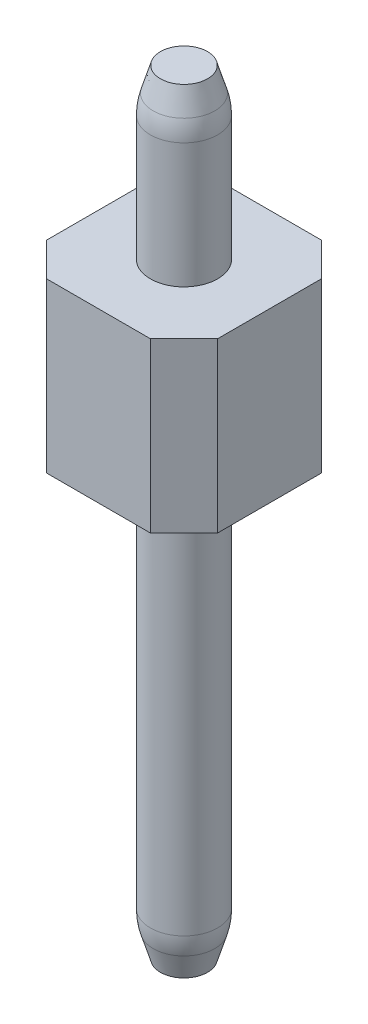
from build123d import *
from OCP.BRepFilletAPI import BRepFilletAPI_MakeChamfer

# Parameters (mm, degrees)
SKETCH1_R               = 0.5
BOSS_EXTRUDE1_DEPTH     = 11.5
BOSS_EXTRUDE1_2_DEPTH   = 11.5
BOSS_EXTRUDE1_3_DEPTH   = 11.5
BOSS_EXTRUDE1_4_DEPTH   = 11.5
BOSS_EXTRUDE1_5_DEPTH   = 11.5
BOSS_EXTRUDE1_6_DEPTH   = 11.5
BOSS_EXTRUDE1_7_DEPTH   = 11.5
BOSS_EXTRUDE1_8_DEPTH   = 11.5
BOSS_EXTRUDE1_9_DEPTH   = 11.5
BOSS_EXTRUDE1_10_DEPTH  = 11.5
BOSS_EXTRUDE1_11_DEPTH  = 11.5
BOSS_EXTRUDE1_12_DEPTH  = 11.5
BOSS_EXTRUDE1_13_DEPTH  = 11.5
BOSS_EXTRUDE1_14_DEPTH  = 11.5
BOSS_EXTRUDE1_15_DEPTH  = 11.5
BOSS_EXTRUDE1_16_DEPTH  = 11.5
BOSS_EXTRUDE2_DEPTH     = 2.5
CHAMFER1_SIZE           = 0.5
CHAMFER1_SIZE2          = 0.15
FILLET1_R               = 1
CHAMFER2_SIZE           = 0.15
CHAMFER2_SIZE2          = 0.5
FILLET2_R               = 1
CUT_EXTRUDE1_DEPTH      = 42.093776929
CUT_EXTRUDE1_DEPTH_BACK = 42.093776929
SKETCH3_W               = 38.1
SKETCH3_H               = 11.5


with BuildPart() as part:
    # Sketch1 → Boss-Extrude1 (new body)
    with BuildSketch(Plane(origin=(0, 0, 0), x_dir=(1, 0, 0), z_dir=(0, 1, 0))):
        with Locations(Location((0, 0, 0), (0, 0, 270))):
            Circle(SKETCH1_R)
    extrude(amount=BOSS_EXTRUDE1_DEPTH)



with BuildPart() as body_2:
    # Sketch1 → Boss-Extrude1 2 (new body)
    with BuildSketch(Plane(origin=(0, 0, 0), x_dir=(1, 0, 0), z_dir=(0, 1, 0))):
        with Locations(Location((2.54, 0, 0), (0, 0, 270))):
            Circle(SKETCH1_R)
    extrude(amount=BOSS_EXTRUDE1_2_DEPTH)


with BuildPart() as body_3:
    # Sketch1 → Boss-Extrude1 3 (new body)
    with BuildSketch(Plane(origin=(0, 0, 0), x_dir=(1, 0, 0), z_dir=(0, 1, 0))):
        with Locations(Location((5.08, 0, 0), (0, 0, 270))):
            Circle(SKETCH1_R)
    extrude(amount=BOSS_EXTRUDE1_3_DEPTH)


with BuildPart() as body_4:
    # Sketch1 → Boss-Extrude1 4 (new body)
    with BuildSketch(Plane(origin=(0, 0, 0), x_dir=(1, 0, 0), z_dir=(0, 1, 0))):
        with Locations(Location((7.62, 0, 0), (0, 0, 270))):
            Circle(SKETCH1_R)
    extrude(amount=BOSS_EXTRUDE1_4_DEPTH)


with BuildPart() as body_5:
    # Sketch1 → Boss-Extrude1 5 (new body)
    with BuildSketch(Plane(origin=(0, 0, 0), x_dir=(1, 0, 0), z_dir=(0, 1, 0))):
        with Locations(Location((10.16, 0, 0), (0, 0, 270))):
            Circle(SKETCH1_R)
    extrude(amount=BOSS_EXTRUDE1_5_DEPTH)


with BuildPart() as body_6:
    # Sketch1 → Boss-Extrude1 6 (new body)
    with BuildSketch(Plane(origin=(0, 0, 0), x_dir=(1, 0, 0), z_dir=(0, 1, 0))):
        with Locations(Location((12.7, 0, 0), (0, 0, 270))):
            Circle(SKETCH1_R)
    extrude(amount=BOSS_EXTRUDE1_6_DEPTH)


with BuildPart() as body_7:
    # Sketch1 → Boss-Extrude1 7 (new body)
    with BuildSketch(Plane(origin=(0, 0, 0), x_dir=(1, 0, 0), z_dir=(0, 1, 0))):
        with Locations(Location((15.24, 0, 0), (0, 0, 270))):
            Circle(SKETCH1_R)
    extrude(amount=BOSS_EXTRUDE1_7_DEPTH)


with BuildPart() as body_8:
    # Sketch1 → Boss-Extrude1 8 (new body)
    with BuildSketch(Plane(origin=(0, 0, 0), x_dir=(1, 0, 0), z_dir=(0, 1, 0))):
        with Locations(Location((17.78, 0, 0), (0, 0, 270))):
            Circle(SKETCH1_R)
    extrude(amount=BOSS_EXTRUDE1_8_DEPTH)


with BuildPart() as body_9:
    # Sketch1 → Boss-Extrude1 9 (new body)
    with BuildSketch(Plane(origin=(0, 0, 0), x_dir=(1, 0, 0), z_dir=(0, 1, 0))):
        with Locations(Location((20.32, 0, 0), (0, 0, 270))):
            Circle(SKETCH1_R)
    extrude(amount=BOSS_EXTRUDE1_9_DEPTH)


with BuildPart() as body_10:
    # Sketch1 → Boss-Extrude1 10 (new body)
    with BuildSketch(Plane(origin=(0, 0, 0), x_dir=(1, 0, 0), z_dir=(0, 1, 0))):
        with Locations(Location((22.86, 0, 0), (0, 0, 270))):
            Circle(SKETCH1_R)
    extrude(amount=BOSS_EXTRUDE1_10_DEPTH)


with BuildPart() as body_11:
    # Sketch1 → Boss-Extrude1 11 (new body)
    with BuildSketch(Plane(origin=(0, 0, 0), x_dir=(1, 0, 0), z_dir=(0, 1, 0))):
        with Locations(Location((25.4, 0, 0), (0, 0, 270))):
            Circle(SKETCH1_R)
    extrude(amount=BOSS_EXTRUDE1_11_DEPTH)


with BuildPart() as body_12:
    # Sketch1 → Boss-Extrude1 12 (new body)
    with BuildSketch(Plane(origin=(0, 0, 0), x_dir=(1, 0, 0), z_dir=(0, 1, 0))):
        with Locations(Location((27.94, 0, 0), (0, 0, 270))):
            Circle(SKETCH1_R)
    extrude(amount=BOSS_EXTRUDE1_12_DEPTH)


with BuildPart() as body_13:
    # Sketch1 → Boss-Extrude1 13 (new body)
    with BuildSketch(Plane(origin=(0, 0, 0), x_dir=(1, 0, 0), z_dir=(0, 1, 0))):
        with Locations(Location((30.48, 0, 0), (0, 0, 270))):
            Circle(SKETCH1_R)
    extrude(amount=BOSS_EXTRUDE1_13_DEPTH)


with BuildPart() as body_14:
    # Sketch1 → Boss-Extrude1 14 (new body)
    with BuildSketch(Plane(origin=(0, 0, 0), x_dir=(1, 0, 0), z_dir=(0, 1, 0))):
        with Locations(Location((33.02, 0, 0), (0, 0, 270))):
            Circle(SKETCH1_R)
    extrude(amount=BOSS_EXTRUDE1_14_DEPTH)


with BuildPart() as body_15:
    # Sketch1 → Boss-Extrude1 15 (new body)
    with BuildSketch(Plane(origin=(0, 0, 0), x_dir=(1, 0, 0), z_dir=(0, 1, 0))):
        with Locations(Location((35.56, 0, 0), (0, 0, 270))):
            Circle(SKETCH1_R)
    extrude(amount=BOSS_EXTRUDE1_15_DEPTH)


with BuildPart() as body_16:
    # Sketch1 → Boss-Extrude1 16 (new body)
    with BuildSketch(Plane(origin=(0, 0, 0), x_dir=(1, 0, 0), z_dir=(0, 1, 0))):
        with Locations(Location((38.1, 0, 0), (0, 0, 270))):
            Circle(SKETCH1_R)
    extrude(amount=BOSS_EXTRUDE1_16_DEPTH)


with BuildPart() as part_1:
    add(part.part)

    add(body_2.part)  # Boss-Extrude2 merges body 2

    add(body_3.part)  # Boss-Extrude2 merges body 3

    add(body_4.part)  # Boss-Extrude2 merges body 4

    add(body_5.part)  # Boss-Extrude2 merges body 5

    add(body_6.part)  # Boss-Extrude2 merges body 6

    add(body_7.part)  # Boss-Extrude2 merges body 7

    add(body_8.part)  # Boss-Extrude2 merges body 8

    add(body_9.part)  # Boss-Extrude2 merges body 9

    add(body_10.part)  # Boss-Extrude2 merges body 10

    add(body_11.part)  # Boss-Extrude2 merges body 11

    add(body_12.part)  # Boss-Extrude2 merges body 12

    add(body_13.part)  # Boss-Extrude2 merges body 13

    add(body_14.part)  # Boss-Extrude2 merges body 14

    add(body_15.part)  # Boss-Extrude2 merges body 15

    add(body_16.part)  # Boss-Extrude2 merges body 16
    # Sketch2 → Boss-Extrude2 (add)
    with BuildSketch(Plane(origin=(0, 6.5, 0), x_dir=(1, 0, 0), z_dir=(0, 1, 0))):
        Polygon((-1.27, 0.77), (-0.77, 1.27), (0.77, 1.27), (1.27, 0.77), (1.77, 1.27), (3.31, 1.27), (3.81, 0.77), (4.31, 1.27), (5.85, 1.27), (6.35, 0.77), (6.85, 1.27), (8.39, 1.27), (8.89, 0.77), (9.39, 1.27), (10.93, 1.27), (11.43, 0.77), (11.93, 1.27), (13.47, 1.27), (13.97, 0.77), (14.47, 1.27), (16.01, 1.27), (16.51, 0.77), (17.01, 1.27), (18.55, 1.27), (19.05, 0.77), (19.55, 1.27), (21.09, 1.27), (21.59, 0.77), (22.09, 1.27), (23.63, 1.27), (24.13, 0.77), (24.63, 1.27), (26.17, 1.27), (26.67, 0.77), (27.17, 1.27), (28.71, 1.27), (29.21, 0.77), (29.71, 1.27), (31.25, 1.27), (31.75, 0.77), (32.25, 1.27), (33.79, 1.27), (34.29, 0.77), (34.79, 1.27), (36.33, 1.27), (36.83, 0.77), (37.33, 1.27), (38.87, 1.27), (39.37, 0.77), (39.37, -0.77), (38.87, -1.27), (37.33, -1.27), (36.83, -0.77), (36.33, -1.27), (34.79, -1.27), (34.29, -0.77), (33.79, -1.27), (32.25, -1.27), (31.75, -0.77), (31.25, -1.27), (29.71, -1.27), (29.21, -0.77), (28.71, -1.27), (27.17, -1.27), (26.67, -0.77), (26.17, -1.27), (24.63, -1.27), (24.13, -0.77), (23.63, -1.27), (22.09, -1.27), (21.59, -0.77), (21.09, -1.27), (19.55, -1.27), (19.05, -0.77), (18.55, -1.27), (17.01, -1.27), (16.51, -0.77), (16.01, -1.27), (14.47, -1.27), (13.97, -0.77), (13.47, -1.27), (11.93, -1.27), (11.43, -0.77), (10.93, -1.27), (9.39, -1.27), (8.89, -0.77), (8.39, -1.27), (6.85, -1.27), (6.35, -0.77), (5.85, -1.27), (4.31, -1.27), (3.81, -0.77), (3.31, -1.27), (1.77, -1.27), (1.27, -0.77), (0.77, -1.27), (-0.77, -1.27), (-1.27, -0.77), align=None)
    extrude(amount=BOSS_EXTRUDE2_DEPTH)

    # Chamfer1: one chamfer whose edges measure the first distance from different faces: ONE call of the kernel's chamfer builder (chamfer() names one face for all edges)
    chamfer1_edges_1 = [part_1.edges().sort_by_distance(p)[0] for p in [
        (2.54, 11.5, -0.5),
    ]]
    chamfer1_side_1 = [part_1.faces().sort_by_distance(p)[0] for p in [
        (2.54, 10.25, -0.5),
    ]]
    chamfer1_edges_2 = [part_1.edges().sort_by_distance(p)[0] for p in [
        (5.08, 11.5, -0.5),
    ]]
    chamfer1_side_2 = [part_1.faces().sort_by_distance(p)[0] for p in [
        (5.08, 10.25, -0.5),
    ]]
    chamfer1_edges_3 = [part_1.edges().sort_by_distance(p)[0] for p in [
        (7.62, 11.5, -0.5),
    ]]
    chamfer1_side_3 = [part_1.faces().sort_by_distance(p)[0] for p in [
        (7.62, 10.25, -0.5),
    ]]
    chamfer1_edges_4 = [part_1.edges().sort_by_distance(p)[0] for p in [
        (10.16, 11.5, -0.5),
    ]]
    chamfer1_side_4 = [part_1.faces().sort_by_distance(p)[0] for p in [
        (10.16, 10.25, -0.5),
    ]]
    chamfer1_edges_5 = [part_1.edges().sort_by_distance(p)[0] for p in [
        (12.7, 11.5, -0.5),
    ]]
    chamfer1_side_5 = [part_1.faces().sort_by_distance(p)[0] for p in [
        (12.7, 10.25, -0.5),
    ]]
    chamfer1_edges_6 = [part_1.edges().sort_by_distance(p)[0] for p in [
        (15.24, 11.5, -0.5),
    ]]
    chamfer1_side_6 = [part_1.faces().sort_by_distance(p)[0] for p in [
        (15.24, 10.25, -0.5),
    ]]
    chamfer1_edges_7 = [part_1.edges().sort_by_distance(p)[0] for p in [
        (17.78, 11.5, -0.5),
    ]]
    chamfer1_side_7 = [part_1.faces().sort_by_distance(p)[0] for p in [
        (17.78, 10.25, -0.5),
    ]]
    chamfer1_edges_8 = [part_1.edges().sort_by_distance(p)[0] for p in [
        (20.32, 11.5, -0.5),
    ]]
    chamfer1_side_8 = [part_1.faces().sort_by_distance(p)[0] for p in [
        (20.32, 10.25, -0.5),
    ]]
    chamfer1_edges_9 = [part_1.edges().sort_by_distance(p)[0] for p in [
        (22.86, 11.5, -0.5),
    ]]
    chamfer1_side_9 = [part_1.faces().sort_by_distance(p)[0] for p in [
        (22.86, 10.25, -0.5),
    ]]
    chamfer1_edges_10 = [part_1.edges().sort_by_distance(p)[0] for p in [
        (25.4, 11.5, -0.5),
    ]]
    chamfer1_side_10 = [part_1.faces().sort_by_distance(p)[0] for p in [
        (25.4, 10.25, -0.5),
    ]]
    chamfer1_edges_11 = [part_1.edges().sort_by_distance(p)[0] for p in [
        (27.94, 11.5, -0.5),
    ]]
    chamfer1_side_11 = [part_1.faces().sort_by_distance(p)[0] for p in [
        (27.94, 10.25, -0.5),
    ]]
    chamfer1_edges_12 = [part_1.edges().sort_by_distance(p)[0] for p in [
        (30.48, 11.5, -0.5),
    ]]
    chamfer1_side_12 = [part_1.faces().sort_by_distance(p)[0] for p in [
        (30.48, 10.25, -0.5),
    ]]
    chamfer1_edges_13 = [part_1.edges().sort_by_distance(p)[0] for p in [
        (33.02, 11.5, -0.5),
    ]]
    chamfer1_side_13 = [part_1.faces().sort_by_distance(p)[0] for p in [
        (33.02, 10.25, -0.5),
    ]]
    chamfer1_edges_14 = [part_1.edges().sort_by_distance(p)[0] for p in [
        (35.56, 11.5, -0.5),
    ]]
    chamfer1_side_14 = [part_1.faces().sort_by_distance(p)[0] for p in [
        (35.56, 10.25, -0.5),
    ]]
    chamfer1_edges_15 = [part_1.edges().sort_by_distance(p)[0] for p in [
        (38.1, 11.5, -0.5),
    ]]
    chamfer1_side_15 = [part_1.faces().sort_by_distance(p)[0] for p in [
        (38.1, 10.25, -0.5),
    ]]
    chamfer1_edges_16 = [part_1.edges().sort_by_distance(p)[0] for p in [
        (0, 11.5, -0.5),
    ]]
    chamfer1_side_16 = [part_1.faces().sort_by_distance(p)[0] for p in [
        (0, 10.25, -0.5),
    ]]
    chamfer1 = BRepFilletAPI_MakeChamfer(part_1.part.solid().wrapped)
    for e in chamfer1_edges_1:
        chamfer1.Add(CHAMFER1_SIZE, CHAMFER1_SIZE2, e.wrapped, chamfer1_side_1[0].wrapped)  # the first distance lies on this face
    for e in chamfer1_edges_2:
        chamfer1.Add(CHAMFER1_SIZE, CHAMFER1_SIZE2, e.wrapped, chamfer1_side_2[0].wrapped)  # the first distance lies on this face
    for e in chamfer1_edges_3:
        chamfer1.Add(CHAMFER1_SIZE, CHAMFER1_SIZE2, e.wrapped, chamfer1_side_3[0].wrapped)  # the first distance lies on this face
    for e in chamfer1_edges_4:
        chamfer1.Add(CHAMFER1_SIZE, CHAMFER1_SIZE2, e.wrapped, chamfer1_side_4[0].wrapped)  # the first distance lies on this face
    for e in chamfer1_edges_5:
        chamfer1.Add(CHAMFER1_SIZE, CHAMFER1_SIZE2, e.wrapped, chamfer1_side_5[0].wrapped)  # the first distance lies on this face
    for e in chamfer1_edges_6:
        chamfer1.Add(CHAMFER1_SIZE, CHAMFER1_SIZE2, e.wrapped, chamfer1_side_6[0].wrapped)  # the first distance lies on this face
    for e in chamfer1_edges_7:
        chamfer1.Add(CHAMFER1_SIZE, CHAMFER1_SIZE2, e.wrapped, chamfer1_side_7[0].wrapped)  # the first distance lies on this face
    for e in chamfer1_edges_8:
        chamfer1.Add(CHAMFER1_SIZE, CHAMFER1_SIZE2, e.wrapped, chamfer1_side_8[0].wrapped)  # the first distance lies on this face
    for e in chamfer1_edges_9:
        chamfer1.Add(CHAMFER1_SIZE, CHAMFER1_SIZE2, e.wrapped, chamfer1_side_9[0].wrapped)  # the first distance lies on this face
    for e in chamfer1_edges_10:
        chamfer1.Add(CHAMFER1_SIZE, CHAMFER1_SIZE2, e.wrapped, chamfer1_side_10[0].wrapped)  # the first distance lies on this face
    for e in chamfer1_edges_11:
        chamfer1.Add(CHAMFER1_SIZE, CHAMFER1_SIZE2, e.wrapped, chamfer1_side_11[0].wrapped)  # the first distance lies on this face
    for e in chamfer1_edges_12:
        chamfer1.Add(CHAMFER1_SIZE, CHAMFER1_SIZE2, e.wrapped, chamfer1_side_12[0].wrapped)  # the first distance lies on this face
    for e in chamfer1_edges_13:
        chamfer1.Add(CHAMFER1_SIZE, CHAMFER1_SIZE2, e.wrapped, chamfer1_side_13[0].wrapped)  # the first distance lies on this face
    for e in chamfer1_edges_14:
        chamfer1.Add(CHAMFER1_SIZE, CHAMFER1_SIZE2, e.wrapped, chamfer1_side_14[0].wrapped)  # the first distance lies on this face
    for e in chamfer1_edges_15:
        chamfer1.Add(CHAMFER1_SIZE, CHAMFER1_SIZE2, e.wrapped, chamfer1_side_15[0].wrapped)  # the first distance lies on this face
    for e in chamfer1_edges_16:
        chamfer1.Add(CHAMFER1_SIZE, CHAMFER1_SIZE2, e.wrapped, chamfer1_side_16[0].wrapped)  # the first distance lies on this face
    add(Compound.cast(chamfer1.Shape()), mode=Mode.REPLACE)

    # Fillet1
    fillet1_edges = [part_1.edges().sort_by_distance(p)[0] for p in [
        (38.1, 11, -0.5),
        (35.56, 11, -0.5),
        (33.02, 11, -0.5),
        (30.48, 11, -0.5),
        (27.94, 11, -0.5),
        (25.4, 11, -0.5),
        (22.86, 11, -0.5),
        (20.32, 11, -0.5),
        (17.78, 11, -0.5),
        (15.24, 11, -0.5),
        (12.7, 11, -0.5),
        (10.16, 11, -0.5),
        (7.62, 11, -0.5),
        (5.08, 11, -0.5),
        (2.54, 11, -0.5),
        (0, 11, -0.5),
    ]]
    fillet(fillet1_edges, radius=FILLET1_R)

    # Chamfer2: one chamfer whose edges measure the first distance from different faces: ONE call of the kernel's chamfer builder (chamfer() names one face for all edges)
    chamfer2_edges_1 = [part_1.edges().sort_by_distance(p)[0] for p in [
        (0, 0, -0.5),
    ]]
    chamfer2_side_1 = [part_1.faces().sort_by_distance(p)[0] for p in [
        (0, 0, 0),
    ]]
    chamfer2_edges_2 = [part_1.edges().sort_by_distance(p)[0] for p in [
        (2.54, 0, -0.5),
    ]]
    chamfer2_side_2 = [part_1.faces().sort_by_distance(p)[0] for p in [
        (2.54, 0, 0),
    ]]
    chamfer2_edges_3 = [part_1.edges().sort_by_distance(p)[0] for p in [
        (5.08, 0, -0.5),
    ]]
    chamfer2_side_3 = [part_1.faces().sort_by_distance(p)[0] for p in [
        (5.08, 0, 0),
    ]]
    chamfer2_edges_4 = [part_1.edges().sort_by_distance(p)[0] for p in [
        (7.62, 0, -0.5),
    ]]
    chamfer2_side_4 = [part_1.faces().sort_by_distance(p)[0] for p in [
        (7.62, 0, 0),
    ]]
    chamfer2_edges_5 = [part_1.edges().sort_by_distance(p)[0] for p in [
        (10.16, 0, -0.5),
    ]]
    chamfer2_side_5 = [part_1.faces().sort_by_distance(p)[0] for p in [
        (10.16, 0, 0),
    ]]
    chamfer2_edges_6 = [part_1.edges().sort_by_distance(p)[0] for p in [
        (12.7, 0, -0.5),
    ]]
    chamfer2_side_6 = [part_1.faces().sort_by_distance(p)[0] for p in [
        (12.7, 0, 0),
    ]]
    chamfer2_edges_7 = [part_1.edges().sort_by_distance(p)[0] for p in [
        (15.24, 0, -0.5),
    ]]
    chamfer2_side_7 = [part_1.faces().sort_by_distance(p)[0] for p in [
        (15.24, 0, 0),
    ]]
    chamfer2_edges_8 = [part_1.edges().sort_by_distance(p)[0] for p in [
        (17.78, 0, -0.5),
    ]]
    chamfer2_side_8 = [part_1.faces().sort_by_distance(p)[0] for p in [
        (17.78, 0, 0),
    ]]
    chamfer2_edges_9 = [part_1.edges().sort_by_distance(p)[0] for p in [
        (20.32, 0, -0.5),
    ]]
    chamfer2_side_9 = [part_1.faces().sort_by_distance(p)[0] for p in [
        (20.32, 0, 0),
    ]]
    chamfer2_edges_10 = [part_1.edges().sort_by_distance(p)[0] for p in [
        (22.86, 0, -0.5),
    ]]
    chamfer2_side_10 = [part_1.faces().sort_by_distance(p)[0] for p in [
        (22.86, 0, 0),
    ]]
    chamfer2_edges_11 = [part_1.edges().sort_by_distance(p)[0] for p in [
        (25.4, 0, -0.5),
    ]]
    chamfer2_side_11 = [part_1.faces().sort_by_distance(p)[0] for p in [
        (25.4, 0, 0),
    ]]
    chamfer2_edges_12 = [part_1.edges().sort_by_distance(p)[0] for p in [
        (27.94, 0, -0.5),
    ]]
    chamfer2_side_12 = [part_1.faces().sort_by_distance(p)[0] for p in [
        (27.94, 0, 0),
    ]]
    chamfer2_edges_13 = [part_1.edges().sort_by_distance(p)[0] for p in [
        (30.48, 0, -0.5),
    ]]
    chamfer2_side_13 = [part_1.faces().sort_by_distance(p)[0] for p in [
        (30.48, 0, 0),
    ]]
    chamfer2_edges_14 = [part_1.edges().sort_by_distance(p)[0] for p in [
        (33.02, 0, -0.5),
    ]]
    chamfer2_side_14 = [part_1.faces().sort_by_distance(p)[0] for p in [
        (33.02, 0, 0),
    ]]
    chamfer2_edges_15 = [part_1.edges().sort_by_distance(p)[0] for p in [
        (35.56, 0, -0.5),
    ]]
    chamfer2_side_15 = [part_1.faces().sort_by_distance(p)[0] for p in [
        (35.56, 0, 0),
    ]]
    chamfer2_edges_16 = [part_1.edges().sort_by_distance(p)[0] for p in [
        (38.1, 0, -0.5),
    ]]
    chamfer2_side_16 = [part_1.faces().sort_by_distance(p)[0] for p in [
        (38.1, 0, 0),
    ]]
    chamfer2 = BRepFilletAPI_MakeChamfer(part_1.part.solid().wrapped)
    for e in chamfer2_edges_1:
        chamfer2.Add(CHAMFER2_SIZE, CHAMFER2_SIZE2, e.wrapped, chamfer2_side_1[0].wrapped)  # the first distance lies on this face
    for e in chamfer2_edges_2:
        chamfer2.Add(CHAMFER2_SIZE, CHAMFER2_SIZE2, e.wrapped, chamfer2_side_2[0].wrapped)  # the first distance lies on this face
    for e in chamfer2_edges_3:
        chamfer2.Add(CHAMFER2_SIZE, CHAMFER2_SIZE2, e.wrapped, chamfer2_side_3[0].wrapped)  # the first distance lies on this face
    for e in chamfer2_edges_4:
        chamfer2.Add(CHAMFER2_SIZE, CHAMFER2_SIZE2, e.wrapped, chamfer2_side_4[0].wrapped)  # the first distance lies on this face
    for e in chamfer2_edges_5:
        chamfer2.Add(CHAMFER2_SIZE, CHAMFER2_SIZE2, e.wrapped, chamfer2_side_5[0].wrapped)  # the first distance lies on this face
    for e in chamfer2_edges_6:
        chamfer2.Add(CHAMFER2_SIZE, CHAMFER2_SIZE2, e.wrapped, chamfer2_side_6[0].wrapped)  # the first distance lies on this face
    for e in chamfer2_edges_7:
        chamfer2.Add(CHAMFER2_SIZE, CHAMFER2_SIZE2, e.wrapped, chamfer2_side_7[0].wrapped)  # the first distance lies on this face
    for e in chamfer2_edges_8:
        chamfer2.Add(CHAMFER2_SIZE, CHAMFER2_SIZE2, e.wrapped, chamfer2_side_8[0].wrapped)  # the first distance lies on this face
    for e in chamfer2_edges_9:
        chamfer2.Add(CHAMFER2_SIZE, CHAMFER2_SIZE2, e.wrapped, chamfer2_side_9[0].wrapped)  # the first distance lies on this face
    for e in chamfer2_edges_10:
        chamfer2.Add(CHAMFER2_SIZE, CHAMFER2_SIZE2, e.wrapped, chamfer2_side_10[0].wrapped)  # the first distance lies on this face
    for e in chamfer2_edges_11:
        chamfer2.Add(CHAMFER2_SIZE, CHAMFER2_SIZE2, e.wrapped, chamfer2_side_11[0].wrapped)  # the first distance lies on this face
    for e in chamfer2_edges_12:
        chamfer2.Add(CHAMFER2_SIZE, CHAMFER2_SIZE2, e.wrapped, chamfer2_side_12[0].wrapped)  # the first distance lies on this face
    for e in chamfer2_edges_13:
        chamfer2.Add(CHAMFER2_SIZE, CHAMFER2_SIZE2, e.wrapped, chamfer2_side_13[0].wrapped)  # the first distance lies on this face
    for e in chamfer2_edges_14:
        chamfer2.Add(CHAMFER2_SIZE, CHAMFER2_SIZE2, e.wrapped, chamfer2_side_14[0].wrapped)  # the first distance lies on this face
    for e in chamfer2_edges_15:
        chamfer2.Add(CHAMFER2_SIZE, CHAMFER2_SIZE2, e.wrapped, chamfer2_side_15[0].wrapped)  # the first distance lies on this face
    for e in chamfer2_edges_16:
        chamfer2.Add(CHAMFER2_SIZE, CHAMFER2_SIZE2, e.wrapped, chamfer2_side_16[0].wrapped)  # the first distance lies on this face
    add(Compound.cast(chamfer2.Shape()), mode=Mode.REPLACE)

    # Fillet2
    fillet2_edges = [part_1.edges().sort_by_distance(p)[0] for p in [
        (10.16, 0.5, -0.5),
        (17.78, 0.5, -0.5),
        (22.86, 0.5, -0.5),
        (27.94, 0.5, -0.5),
        (30.48, 0.5, -0.5),
        (0, 0.5, -0.5),
        (2.54, 0.5, -0.5),
        (5.08, 0.5, -0.5),
        (7.62, 0.5, -0.5),
        (12.7, 0.5, -0.5),
        (15.24, 0.5, -0.5),
        (20.32, 0.5, -0.5),
        (25.4, 0.5, -0.5),
        (33.02, 0.5, -0.5),
        (35.56, 0.5, -0.5),
        (38.1, 0.5, -0.5),
    ]]
    fillet(fillet2_edges, radius=FILLET2_R)

    # Sketch3 → Cut-Extrude1 (cut, two sides: drawn at the far end of the back side and taken through both)
    with BuildSketch(Plane.XY.offset(1.27).offset(-CUT_EXTRUDE1_DEPTH_BACK)):
        with Locations((20.32, 5.75)):
            Rectangle(SKETCH3_W, SKETCH3_H)
    extrude(amount=CUT_EXTRUDE1_DEPTH + CUT_EXTRUDE1_DEPTH_BACK, mode=Mode.SUBTRACT)


solid = part_1.part
